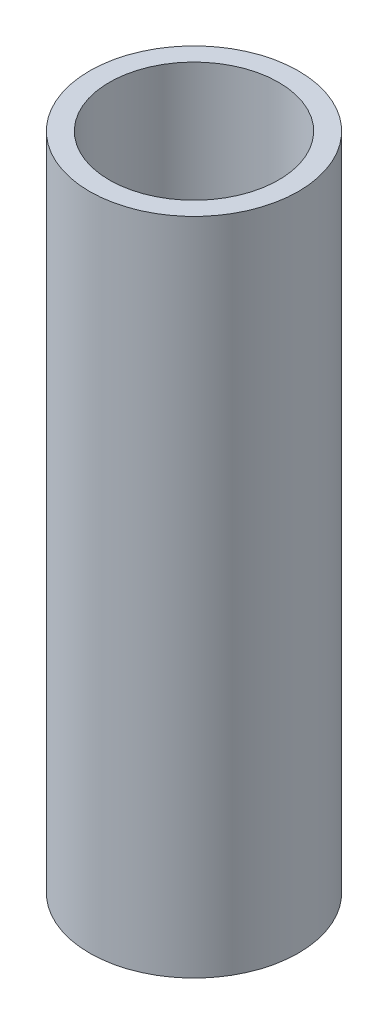
from build123d import *

# Parameters (mm, degrees)
SKETCH1_R           = 2.375
SKETCH1_R_2         = 1.925
BOSS_EXTRUDE1_DEPTH = 15


with BuildPart() as part:
    # Sketch1 → Boss-Extrude1 (new body)
    with BuildSketch(Plane(origin=(0, 0, 0), x_dir=(1, 0, 0), z_dir=(0, 1, 0))):
        with Locations(Location((0, 0, 0), (0, 0, 270))):
            Circle(SKETCH1_R)
        with Locations(Location((0, 0, 0), (0, 0, 270))):
            Circle(SKETCH1_R_2, mode=Mode.SUBTRACT)
    extrude(amount=BOSS_EXTRUDE1_DEPTH)


solid = part.part
